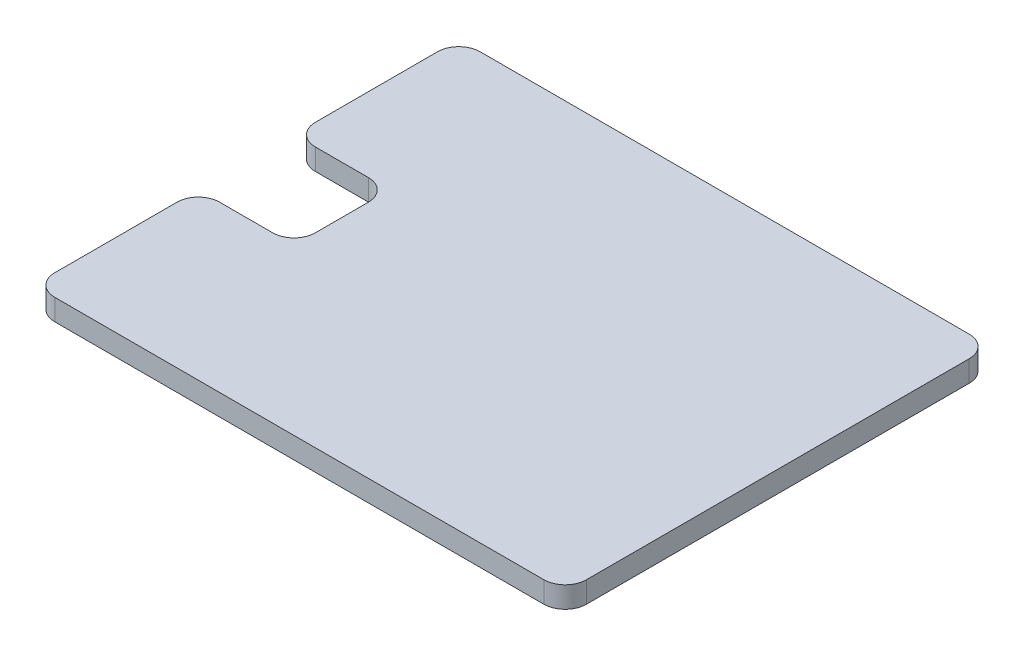
from build123d import *

# Parameters (mm, degrees)
EXTRUDE_3_DEPTH          = 8
SKETCH_4_W               = 50
SKETCH_4_H               = 40
EXTRUDE_4_DEPTH          = 2
FILLET_1_R               = 2
CUT_EXTRUDE_1_DEPTH      = 3
CUT_EXTRUDE_2_DEPTH      = 44.350317185
CUT_EXTRUDE_2_DEPTH_BACK = 44.350317185
SKETCH_3_4_R             = 1.6
SKETCH_6_W               = 9
SKETCH_6_H               = 9
CUT_EXTRUDE_3_DEPTH      = 2
FILLET_3_R               = 2
EXTRUDE_5_DEPTH          = 16


with BuildPart() as part:
    # Эскиз3 → Бобышка-Вытянуть3 (new body)
    with BuildSketch(Plane.XY):
        with BuildLine():
            ThreePointArc((-21.292484919, 9.830060324), (-21.212678125, 0.149287499), (-16.586602566, 8.653589736))
            Line((-16.586602566, 8.653589736), (-15.5, 13))
            Line((-15.5, 13), (-20.5, 13))
            Line((-20.5, 13), (-21.292484919, 9.830060324))
        make_face()
    extrude(amount=EXTRUDE_3_DEPTH)

    # Эскиз4 → Бобышка-Вытянуть4 (add)
    with BuildSketch(Plane(origin=(0, 13, 0), x_dir=(1, 0, 0), z_dir=(0, 1, 0))):
        with Locations((-4.5, -8)):
            Rectangle(SKETCH_4_W, SKETCH_4_H)
    extrude(amount=EXTRUDE_4_DEPTH)

    # Скругление1
    fillet_1_edges = [part.edges().sort_by_distance(p)[0] for p in [
        (20.5, 14, -12),
        (20.5, 14, 28),
        (-29.5, 14, -12),
        (-29.5, 14, 28),
    ]]
    fillet(fillet_1_edges, radius=FILLET_1_R)

    # Эскиз3<3> → Вырез-Вытянуть1 (cut)
    with BuildSketch(Plane.XY):
        Polygon((-21.625, 7.814582562), (-23.25, 5), (-21.625, 2.185417438), (-18.375, 2.185417438), (-16.75, 5), (-18.375, 7.814582562), align=None)
    extrude(amount=CUT_EXTRUDE_1_DEPTH, mode=Mode.SUBTRACT)

    # Эскиз3<4> → Вырез-Вытянуть2 (cut, two sides: drawn at the far end of the back side and taken through both)
    with BuildSketch(Plane.XY.offset(-CUT_EXTRUDE_2_DEPTH_BACK)):
        with Locations((-20, 5)):
            Circle(SKETCH_3_4_R)
    extrude(amount=CUT_EXTRUDE_2_DEPTH + CUT_EXTRUDE_2_DEPTH_BACK, mode=Mode.SUBTRACT)

    # Эскиз6 → Вырез-Вытянуть3 (cut)
    with BuildSketch(Plane(origin=(0, 15, 0), x_dir=(1, 0, 0), z_dir=(0, 1, 0))):
        with Locations((-25, -8)):
            Rectangle(SKETCH_6_W, SKETCH_6_H)
    extrude(amount=-CUT_EXTRUDE_3_DEPTH, mode=Mode.SUBTRACT)

    # Скругление3
    fillet_3_edges = [part.edges().sort_by_distance(p)[0] for p in [
        (-29.5, 14, 12.5),
        (-29.5, 14, 3.5),
        (-20.5, 14, 3.5),
        (-20.5, 14, 12.5),
    ]]
    fillet(fillet_3_edges, radius=FILLET_3_R)

    # Эскиз3<5> → Бобышка-Вытянуть5 (add)
    with BuildSketch(Plane.XY):
        with BuildLine():
            ThreePointArc((-21.292484919, 9.830060324), (-18.787321875, 9.850712501), (-16.586602566, 8.653589736))
            Line((-16.586602566, 8.653589736), (-15.5, 13))
            Line((-15.5, 13), (-20.5, 13))
            Line((-20.5, 13), (-21.292484919, 9.830060324))
        make_face()
    extrude(amount=EXTRUDE_5_DEPTH)


solid = part.part
